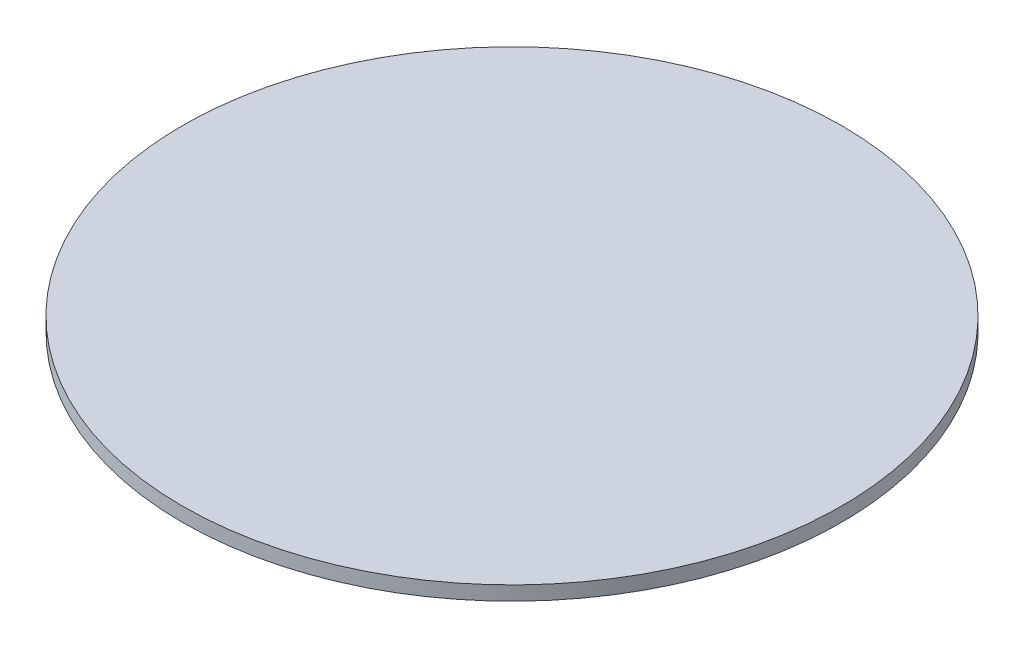
from build123d import *

# Parameters (mm, degrees)
SKETCH1_R           = 70
BOSS_EXTRUDE1_DEPTH = 3


with BuildPart() as part:
    # Sketch1 → Boss-Extrude1 (new body)
    with BuildSketch(Plane(origin=(0, 0, 0), x_dir=(1, 0, 0), z_dir=(0, 1, 0))):
        with Locations(Location((0, 0, 0), (0, 0, 270))):
            Circle(SKETCH1_R)
    extrude(amount=BOSS_EXTRUDE1_DEPTH)


solid = part.part
